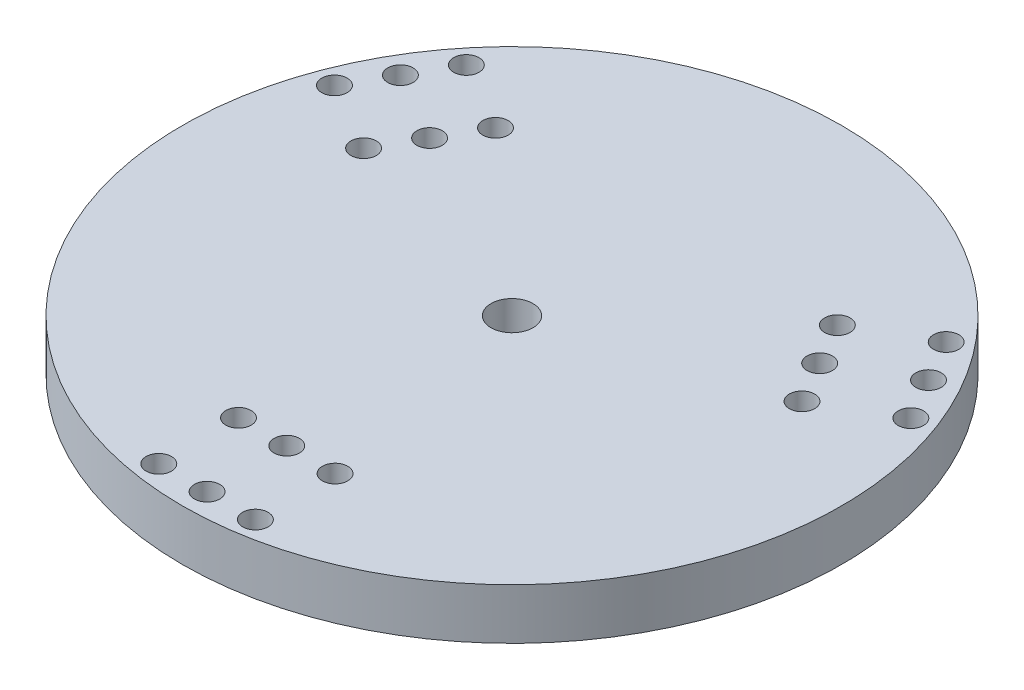
from build123d import *

# Parameters (mm, degrees)
SKETCH16_R          = 64.85
SKETCH16_R_2        = 2.5
SKETCH16_R_3        = 4.1275
BOSS_EXTRUDE1_DEPTH = 10


with BuildPart() as part:
    # Sketch16 → Boss-Extrude1 (new body)
    with BuildSketch(Plane.XZ.offset(-75)):
        with Locations(Location((0, 0, 0), (0, 0, 90))):
            Circle(SKETCH16_R)
        with Locations(Location((38.382245896, -22.16, 0), (0, 0, 90))):
            Circle(SKETCH16_R_2, mode=Mode.SUBTRACT)
        with Locations(Location((51.961524227, -30, 0), (0, 0, 90))):
            Circle(SKETCH16_R_2, mode=Mode.SUBTRACT)
        with Locations(Location((-43.132245896, -13.932758664, 0), (0, 0, 90))):
            Circle(SKETCH16_R_2, mode=Mode.SUBTRACT)
        with Locations(Location((-38.382245896, -22.16, 0), (0, 0, 90))):
            Circle(SKETCH16_R_2, mode=Mode.SUBTRACT)
        with Locations(Location((-51.961524227, -30, 0), (0, 0, 90))):
            Circle(SKETCH16_R_2, mode=Mode.SUBTRACT)
        with Locations(Location((0, 44.32, 0), (0, 0, 90))):
            Circle(SKETCH16_R_2, mode=Mode.SUBTRACT)
        with Locations(Location((0, 60, 0), (0, 0, 90))):
            Circle(SKETCH16_R_2, mode=Mode.SUBTRACT)
        with Locations(Location((-33.632245896, -30.387241336, 0), (0, 0, 90))):
            Circle(SKETCH16_R_2, mode=Mode.SUBTRACT)
        with Locations(Location((-47.211524227, -38.227241336, 0), (0, 0, 90))):
            Circle(SKETCH16_R_2, mode=Mode.SUBTRACT)
        with Locations(Location((-56.711524227, -21.772758664, 0), (0, 0, 90))):
            Circle(SKETCH16_R_2, mode=Mode.SUBTRACT)
        with Locations(Location((9.5, 44.32, 0), (0, 0, 90))):
            Circle(SKETCH16_R_2, mode=Mode.SUBTRACT)
        with Locations(Location((-9.5, 44.32, 0), (0, 0, 90))):
            Circle(SKETCH16_R_2, mode=Mode.SUBTRACT)
        with Locations(Location((-9.5, 60, 0), (0, 0, 90))):
            Circle(SKETCH16_R_2, mode=Mode.SUBTRACT)
        with Locations(Location((9.5, 60, 0), (0, 0, 90))):
            Circle(SKETCH16_R_2, mode=Mode.SUBTRACT)
        with Locations(Location((33.632245896, -30.387241336, 0), (0, 0, 90))):
            Circle(SKETCH16_R_2, mode=Mode.SUBTRACT)
        with Locations(Location((43.132245896, -13.932758664, 0), (0, 0, 90))):
            Circle(SKETCH16_R_2, mode=Mode.SUBTRACT)
        with Locations(Location((56.711524227, -21.772758664, 0), (0, 0, 90))):
            Circle(SKETCH16_R_2, mode=Mode.SUBTRACT)
        with Locations(Location((47.211524227, -38.227241336, 0), (0, 0, 90))):
            Circle(SKETCH16_R_2, mode=Mode.SUBTRACT)
        with Locations(Location((0, 0, 0), (0, 0, 90))):
            Circle(SKETCH16_R_3, mode=Mode.SUBTRACT)
    extrude(amount=BOSS_EXTRUDE1_DEPTH)


solid = part.part
